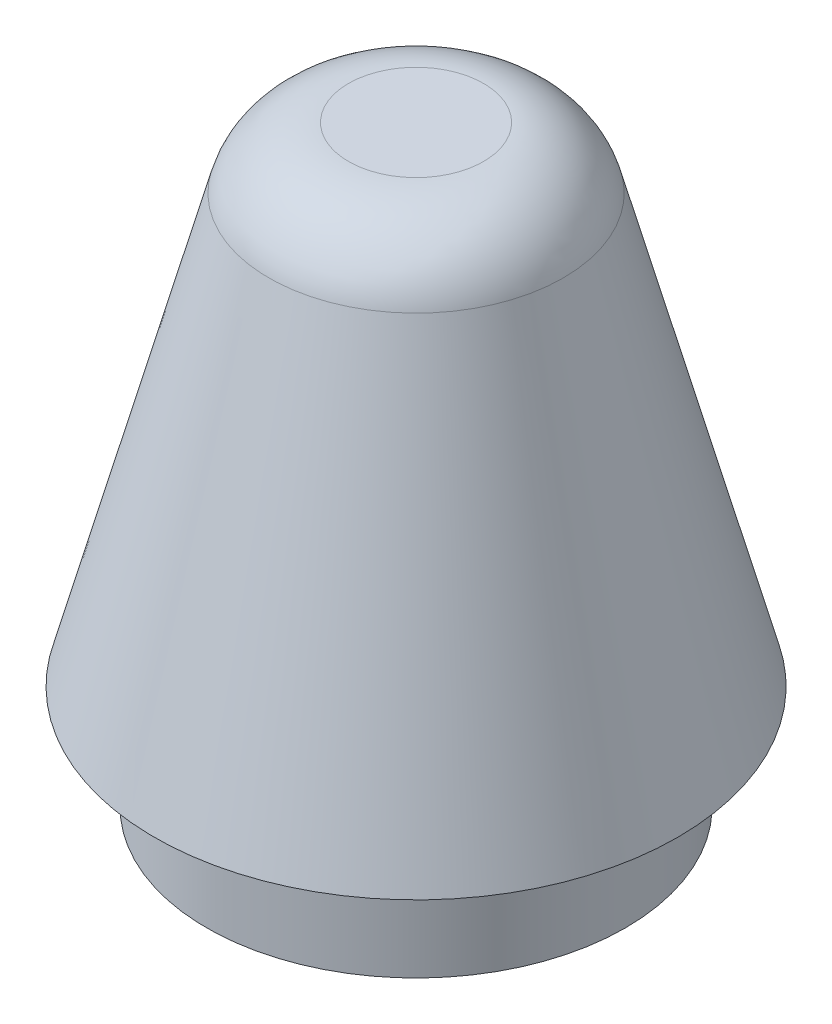
from build123d import *

# Parameters (mm, degrees)
FILLET1_R = 5


with BuildPart() as part:
    # Sketch1 → Revolve1 (revolve)
    with BuildSketch(Plane.XY):
        Polygon((0, 0), (0, 29.623153285), (7.9375, 29.623153285), (15.875, 0), (12.7, 0), (12.7, -6.35), (0, -6.35), align=None)
    revolve(axis=Axis((0, 0, 0), (0, 1, 0)))

    # Fillet1
    fillet1_edges = [part.edges().sort_by_distance(p)[0] for p in [
        (-7.9375, 29.623153285, 0),
    ]]
    fillet(fillet1_edges, radius=FILLET1_R)


solid = part.part
